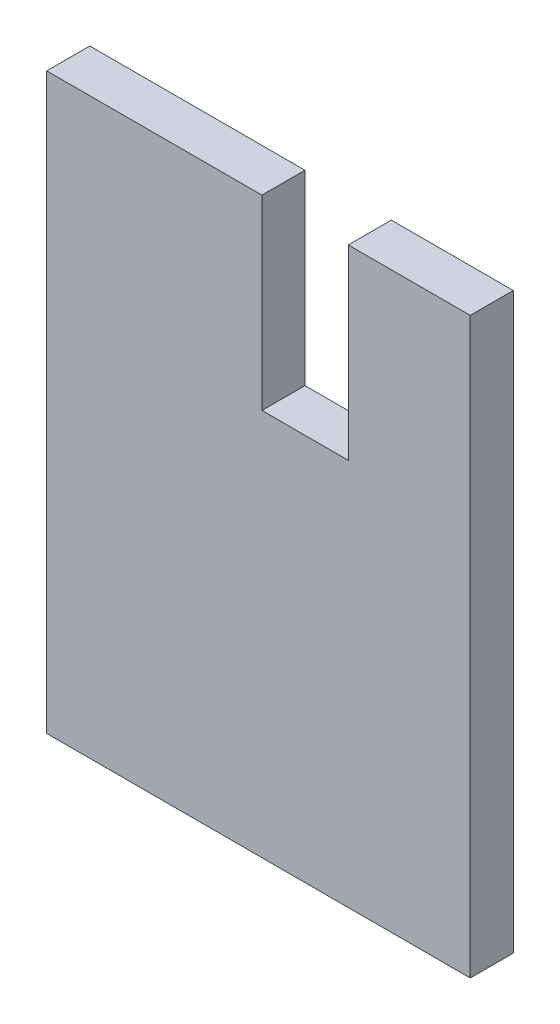
from build123d import *

# Parameters (mm, degrees)
BOSS_EXTRUDE1_DEPTH = 6


with BuildPart() as part:
    # Sketch1 → Boss-Extrude1 (new body)
    with BuildSketch(Plane.XY):
        Polygon((0, 0), (0, 80), (30, 80), (30, 54), (42.04, 54), (42.04, 80), (59.04, 80), (59.04, 0), align=None)
    extrude(amount=BOSS_EXTRUDE1_DEPTH)


solid = part.part
